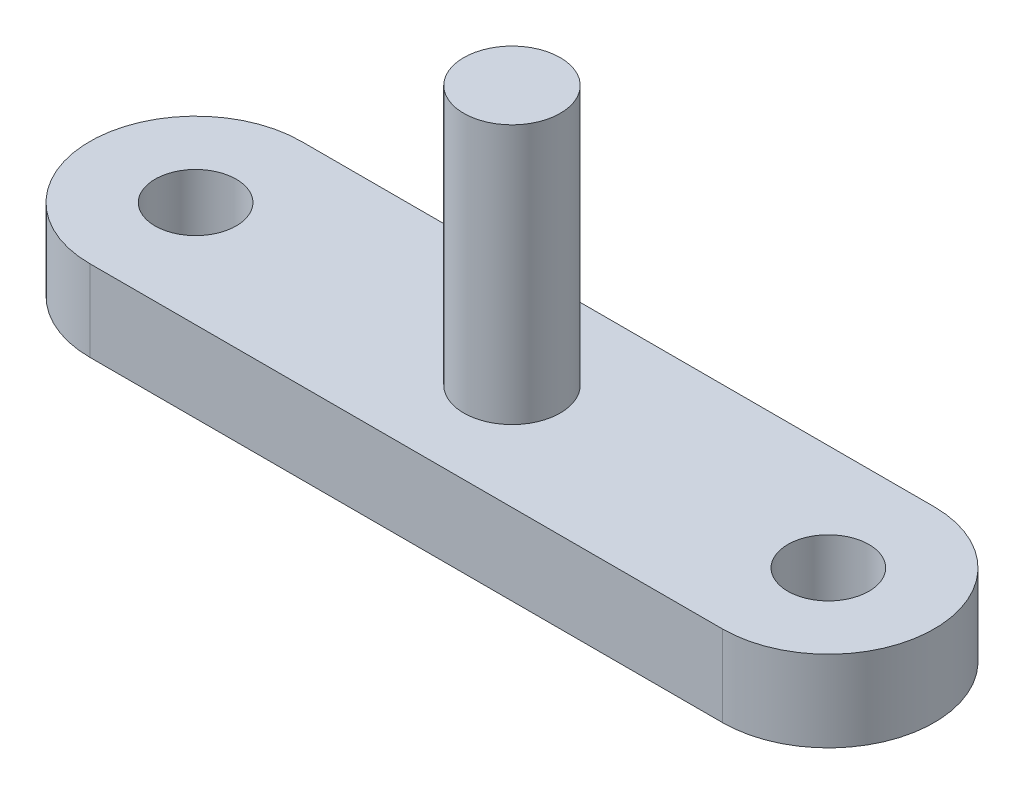
from build123d import *

# Parameters (mm, degrees)
CROQUIS2_R              = 2.5
SALIENTE_EXTRUIR1_DEPTH = 5
CROQUIS2_4_R            = 2.975
SALIENTE_EXTRUIR2_DEPTH = 21


with BuildPart() as part:
    # Croquis2 → Saliente-Extruir1 (new body)
    with BuildSketch(Plane(origin=(0, 0, 0), x_dir=(1, 0, 0), z_dir=(0, 1, 0))):
        with BuildLine():
            Line((19.5, 6.523737612), (-19.5, 6.523737612))
            ThreePointArc((-19.5, 6.523737612), (-26.023737612, 0), (-19.5, -6.523737612))
            Line((-19.5, -6.523737612), (19.5, -6.523737612))
            ThreePointArc((19.5, -6.523737612), (26.023737612, 0), (19.5, 6.523737612))
        make_face()
        with Locations((-19.5, 0)):
            Circle(CROQUIS2_R, mode=Mode.SUBTRACT)
        with BuildLine():
            ThreePointArc((2.975, 0), (0, -2.975), (-2.975, 0))
            ThreePointArc((-2.975, 0), (0, 2.975), (2.975, 0))
        make_face(mode=Mode.SUBTRACT)
        with BuildLine():
            ThreePointArc((22, 0), (19.5, -2.5), (17, 0))
            ThreePointArc((17, 0), (19.5, 2.5), (22, 0))
        make_face(mode=Mode.SUBTRACT)
    extrude(amount=SALIENTE_EXTRUIR1_DEPTH)

    # Croquis2<4> → Saliente-Extruir2 (add)
    with BuildSketch(Plane(origin=(0, 0, 0), x_dir=(1, 0, 0), z_dir=(0, 1, 0))):
        Circle(CROQUIS2_4_R)
    extrude(amount=SALIENTE_EXTRUIR2_DEPTH)


solid = part.part
